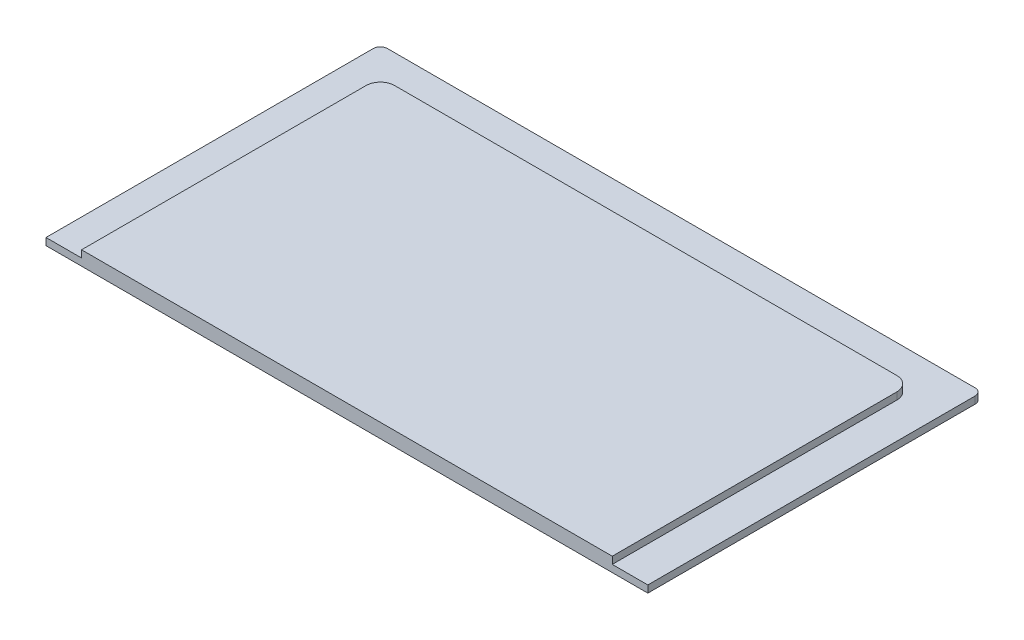
from build123d import *

# Parameters (mm, degrees)
SKETCH_1_W      = 74.6
SKETCH_1_H      = 42
EXTRUDE_1_DEPTH = 1
FILLET_1_R      = 2
SKETCH_2_W      = 84.6
SKETCH_2_H      = 47
EXTRUDE_2_DEPTH = 1
FILLET_2_R      = 1


with BuildPart() as part:
    # Эскиз1 → Бобышка-Вытянуть1 (new body)
    with BuildSketch(Plane(origin=(0, 0, 0), x_dir=(1, 0, 0), z_dir=(0, 1, 0))):
        Rectangle(SKETCH_1_W, SKETCH_1_H)
    extrude(amount=EXTRUDE_1_DEPTH)

    # Скругление1
    fillet_1_edges = [part.edges().sort_by_distance(p)[0] for p in [
        (-37.3, 0.5, -21),
        (37.3, 0.5, -21),
    ]]
    fillet(fillet_1_edges, radius=FILLET_1_R)

    # Эскиз2 → Бобышка-Вытянуть2 (add)
    with BuildSketch(Plane.XZ):
        with Locations((0, -2.5)):
            Rectangle(SKETCH_2_W, SKETCH_2_H)
    extrude(amount=EXTRUDE_2_DEPTH)

    # Скругление2
    fillet_2_edges = [part.edges().sort_by_distance(p)[0] for p in [
        (-42.3, -0.5, -26),
        (42.3, -0.5, -26),
    ]]
    fillet(fillet_2_edges, radius=FILLET_2_R)


solid = part.part
